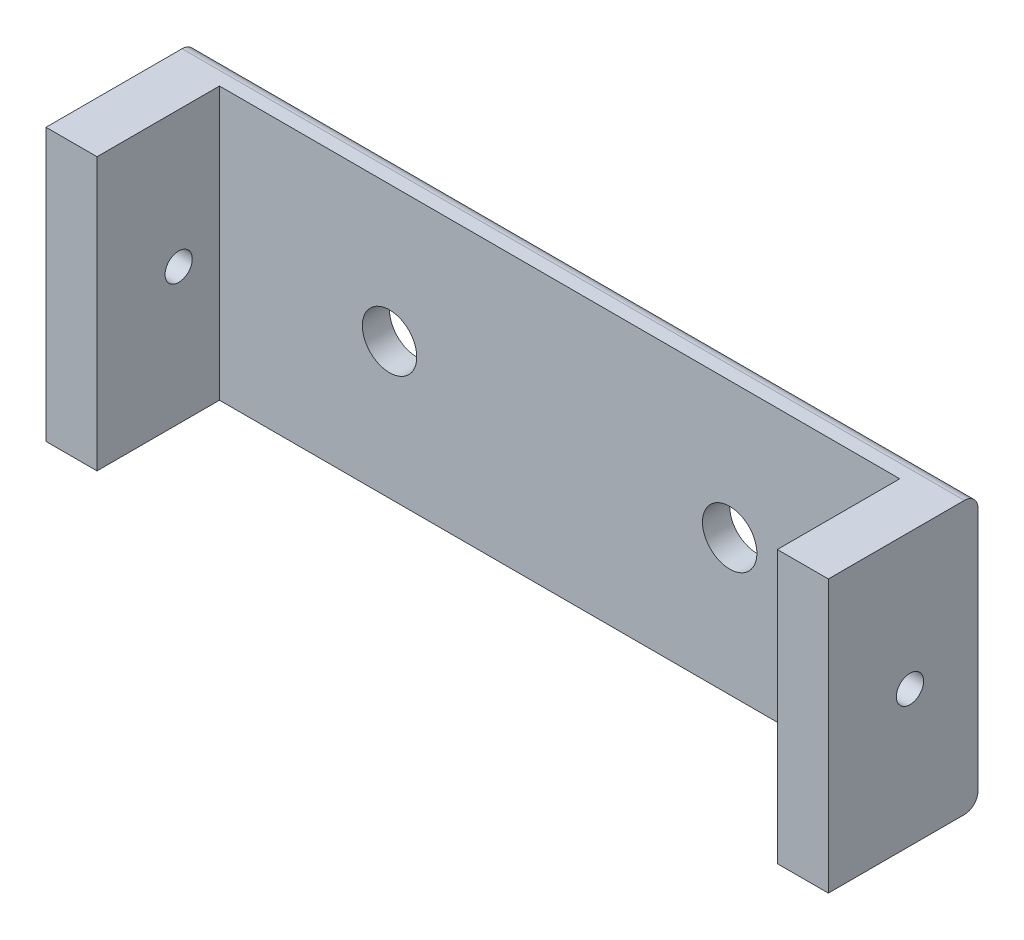
from build123d import *

# Parameters (mm, degrees)
SKETCH_2_W          = 115
SKETCH_2_H          = 40
EXTRUDE_1_DEPTH     = 25
SKETCH_3_W          = 100
SKETCH_3_H          = 40
CUT_EXTRUDE_1_DEPTH = 21
SKETCH_5_R          = 2
CUT_EXTRUDE_2_DEPTH = 138
FILLET_1_R          = 2
FILLET_2_R          = 2
SKETCH_6_R          = 4
CUT_EXTRUDE_3_DEPTH = 9
SKETCH_7_W          = 115
SKETCH_7_H          = 40
CUT_EXTRUDE_4_DEPTH = 3


with BuildPart() as part:
    # 草图2 → 凸台-拉伸1 (new body)
    with BuildSketch(Plane.XY):
        Rectangle(SKETCH_2_W, SKETCH_2_H)
    extrude(amount=EXTRUDE_1_DEPTH)

    # 草图3 → 切除-拉伸1 (cut)
    with BuildSketch(Plane.XY.offset(25)):
        Rectangle(SKETCH_3_W, SKETCH_3_H)
    extrude(amount=-CUT_EXTRUDE_1_DEPTH, mode=Mode.SUBTRACT)

    # 草图5 → 切除-拉伸2 (cut)
    with BuildSketch(Plane.ZY.offset(57.5)):
        with Locations(Location((10, 0, 0), (0, 0, 270))):
            Circle(SKETCH_5_R)
    extrude(amount=-CUT_EXTRUDE_2_DEPTH, mode=Mode.SUBTRACT)

    # 圆角1
    fillet_1_edges = [part.edges().sort_by_distance(p)[0] for p in [
        (0, 20, 0),
    ]]
    fillet(fillet_1_edges, radius=FILLET_1_R)

    # 圆角2
    fillet_2_edges = [part.edges().sort_by_distance(p)[0] for p in [
        (0, -20, 0),
    ]]
    fillet(fillet_2_edges, radius=FILLET_2_R)

    # 草图6 → 切除-拉伸3 (cut)
    with BuildSketch(Plane.XY.offset(4)):
        with Locations((-25, 0)):
            Circle(SKETCH_6_R)
        with Locations(Location((25, 0, 0), (0, 0, 180))):
            Circle(SKETCH_6_R)
    extrude(amount=-CUT_EXTRUDE_3_DEPTH, mode=Mode.SUBTRACT)

    # 草图7 → 切除-拉伸4 (cut)
    with BuildSketch(Plane.XY.offset(25)):
        Rectangle(SKETCH_7_W, SKETCH_7_H)
    extrude(amount=-CUT_EXTRUDE_4_DEPTH, mode=Mode.SUBTRACT)


solid = part.part
